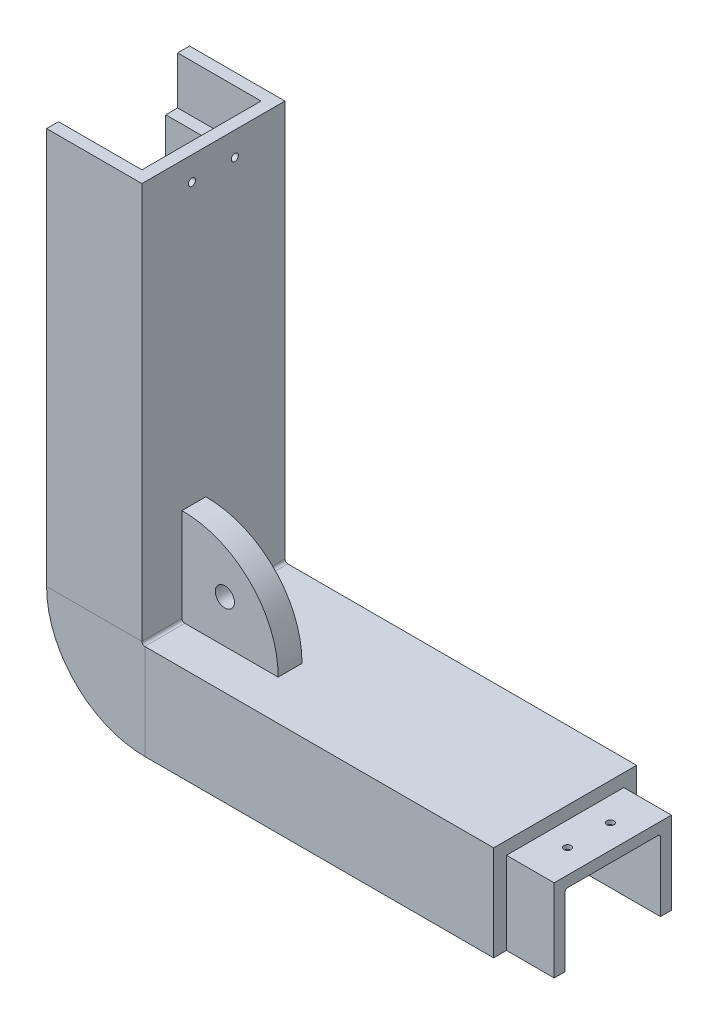
from build123d import *

# Parameters (mm, degrees)
BOSS_EXTRUDE2_START  = 12.7
BOSS_EXTRUDE2_DEPTH  = 12.7
BOSS_EXTRUDE3_DEPTH  = 12.7
SKETCH8_R            = 0.9525
CUT_EXTRUDE1_DEPTH   = 157.544227843
SKETCH9_R            = 0.9525
CUT_EXTRUDE2_DEPTH   = 164.292861742
SKETCH12_R           = 2.5527
BOSS_EXTRUDE10_DEPTH = 3.175


with BuildPart() as part:
    # Sweep1: sweep along a path in Sketch4
    with BuildLine(Plane.XY) as sweep1_path:
        Line((0, 0), (0, -92.964))
        ThreePointArc((0, -92.964), (0.223184633, -93.502815367), (0.762, -93.726))
        Line((0.762, -93.726), (93.726, -93.726))
    # Sketch3 → Sweep1 (sweep)
    with BuildSketch(Plane(origin=(0, 0, 0), x_dir=(1, 0, 0), z_dir=(0, 1, 0))):
        with BuildLine():
            Line((0, 16.62500014), (-25.4, 16.62500014))
            Line((-25.4, 16.62500014), (-25.4, 10.27500014))
            Line((-25.4, 10.27500014), (-6.985, 10.27500014))
            ThreePointArc((-6.985, 10.27500014), (-6.535987194, 10.089012946), (-6.35, 9.64000014))
            Line((-6.35, 9.64000014), (-6.35, -14.48999986))
            ThreePointArc((-6.35, -14.48999986), (-6.535987194, -14.939012666), (-6.985, -15.12499986))
            Line((-6.985, -15.12499986), (-25.4, -15.12499986))
            Line((-25.4, -15.12499986), (-25.4, -21.47499986))
            Line((-25.4, -21.47499986), (0, -21.47499986))
            Line((0, -21.47499986), (0, 16.62500014))
        make_face()
    sweep(path=sweep1_path.line)

    # Sketch6 → Boss-Extrude2 (add)
    with BuildSketch(Plane(origin=(93.726, 0, 0), x_dir=(0, 0, -1), z_dir=(1, 0, 0)).offset(BOSS_EXTRUDE2_START)):
        with BuildLine():
            Line((-18.04599986, -97.155), (13.19600014, -97.155))
            Line((13.19600014, -97.155), (13.19600014, -119.126))
            Line((13.19600014, -119.126), (10.27500014, -119.126))
            Line((10.27500014, -119.126), (10.27500014, -100.711))
            ThreePointArc((10.27500014, -100.711), (10.089012946, -100.261987194), (9.64000014, -100.076))
            Line((9.64000014, -100.076), (-14.48999986, -100.076))
            ThreePointArc((-14.48999986, -100.076), (-14.939012666, -100.261987194), (-15.12499986, -100.711))
            Line((-15.12499986, -100.711), (-15.12499986, -119.126))
            Line((-15.12499986, -119.126), (-18.04599986, -119.126))
            Line((-18.04599986, -119.126), (-18.04599986, -97.155))
        make_face()
    extrude(amount=-BOSS_EXTRUDE2_DEPTH)

    # Sketch7 → Boss-Extrude3 (add)
    with BuildSketch(Plane(origin=(0, 0, 0), x_dir=(1, 0, 0), z_dir=(0, 1, 0))):
        Polygon((-25.4, 13.45000014), (-25.4, 16.62500014), (0, 16.62500014), (0, -21.47499986), (-25.4, -21.47499986), (-25.4, -18.29999986), (-3.175, -18.29999986), (-3.175, 13.45000014), align=None)
    extrude(amount=BOSS_EXTRUDE3_DEPTH)

    # Sketch8 → Cut-Extrude1 (cut, through all)
    with BuildSketch(Plane.XZ.offset(100.076)):
        with Locations(Location((100.076, 8.13999986, 0), (0, 0, 270))):
            Circle(SKETCH8_R)
        with Locations(Location((100.076, -3.29000014, 0), (0, 0, 270))):
            Circle(SKETCH8_R)
    extrude(amount=-CUT_EXTRUDE1_DEPTH, mode=Mode.SUBTRACT)

    # Sketch9 → Cut-Extrude2 (cut, through all)
    with BuildSketch(Plane.ZY.offset(3.175)):
        with Locations((-3.29000014, 6.35)):
            Circle(SKETCH9_R)
        with Locations((8.13999986, 6.35)):
            Circle(SKETCH9_R)
    extrude(amount=-CUT_EXTRUDE2_DEPTH, mode=Mode.SUBTRACT)

    # Sketch12 → Boss-Extrude10 (add, symmetric)
    with BuildSketch(Plane.XY.offset(7.62)):
        with BuildLine():
            Line((0.762, -93.726), (25.622204075, -93.726))
            ThreePointArc((25.622204075, -93.726), (18.183696875, -75.542303125), (0, -68.103795925))
            Line((0, -68.103795925), (0, -92.964))
            ThreePointArc((0, -92.964), (0.223184633, -93.502815367), (0.762, -93.726))
        make_face()
        with Locations((11.43, -82.296)):
            Circle(SKETCH12_R, mode=Mode.SUBTRACT)
    extrude(amount=BOSS_EXTRUDE10_DEPTH, both=True)

    # Sketch14 → CSK for _6 Flat Head Machine Screw _100 (revolve, cut)
    with BuildSketch(Plane(origin=(100.076, -100.076, -3.29000014), x_dir=(0, 0, -1), z_dir=(1, 0, 0))):
        Polygon((0, 0), (0, 2.410824014), (1.89865, 1.27), (1.89865, 1.380025208), (3.5433, 0), align=None)
    revolve(axis=Axis((100.076, -106.426, -3.29000014), (0, 1, 0)), mode=Mode.SUBTRACT)

    # Sketch16 → CSK for _6 Flat Head Machine Screw _ 2 (revolve, cut)
    with BuildSketch(Plane(origin=(100.076, -100.076, 8.13999986), x_dir=(0, 0, -1), z_dir=(1, 0, 0))):
        Polygon((0, 0), (0, 2.410824014), (1.89865, 1.27), (1.89865, 1.380025208), (3.5433, 0), align=None)
    revolve(axis=Axis((100.076, -106.426, 8.13999986), (0, 1, 0)), mode=Mode.SUBTRACT)


solid = part.part
